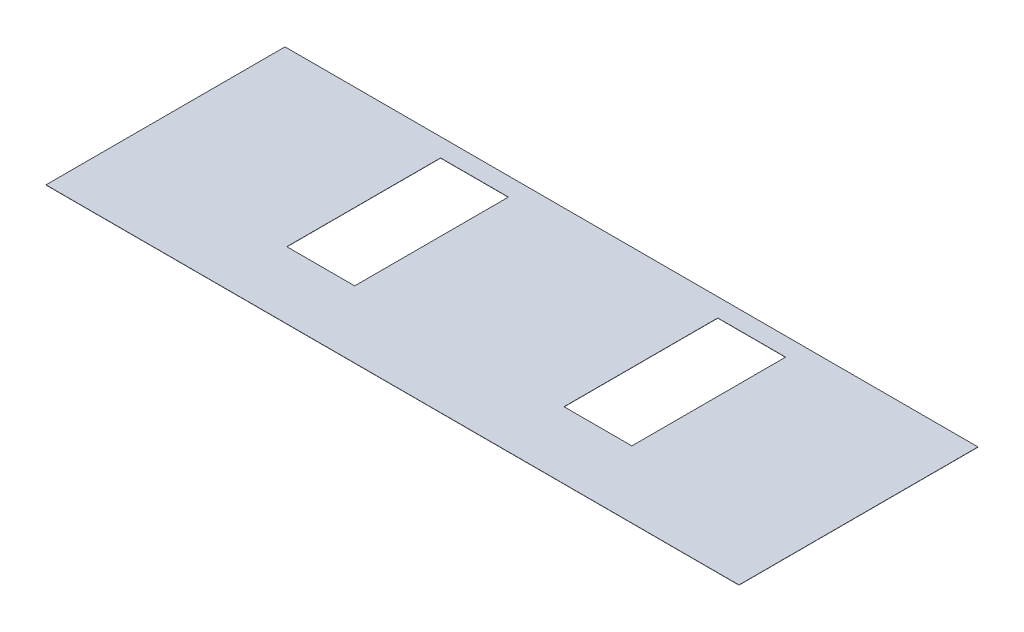
from build123d import *

# Parameters (mm, degrees)
SKETCH1_W               = 6096
SKETCH1_H               = 2102.612
BOSS_EXTRUDE1_DEPTH     = 1.5875
CUT_EXTRUDE1_DEPTH      = 3225.21321035
CUT_EXTRUDE1_DEPTH_BACK = 3225.21321035
SKETCH2_W               = 596.9
SKETCH2_H               = 1352.55


with BuildPart() as part:
    # Sketch1 → Boss-Extrude1 (new body)
    with BuildSketch(Plane(origin=(0, 0, 0), x_dir=(1, 0, 0), z_dir=(0, 1, 0))):
        Rectangle(SKETCH1_W, SKETCH1_H)
    extrude(amount=BOSS_EXTRUDE1_DEPTH)

    # Sketch2 → Cut-Extrude1 (cut, two sides: drawn at the far end of the back side and taken through both)
    with BuildSketch(Plane(origin=(0, 1.5875, 0), x_dir=(1, 0, 0), z_dir=(0, 1, 0)).offset(-CUT_EXTRUDE1_DEPTH_BACK)):
        with Locations((-1219.2, 213.106)):
            Rectangle(SKETCH2_W, SKETCH2_H)
        with Locations((1219.2, 213.106)):
            Rectangle(SKETCH2_W, SKETCH2_H)
    extrude(amount=CUT_EXTRUDE1_DEPTH + CUT_EXTRUDE1_DEPTH_BACK, mode=Mode.SUBTRACT)


solid = part.part
